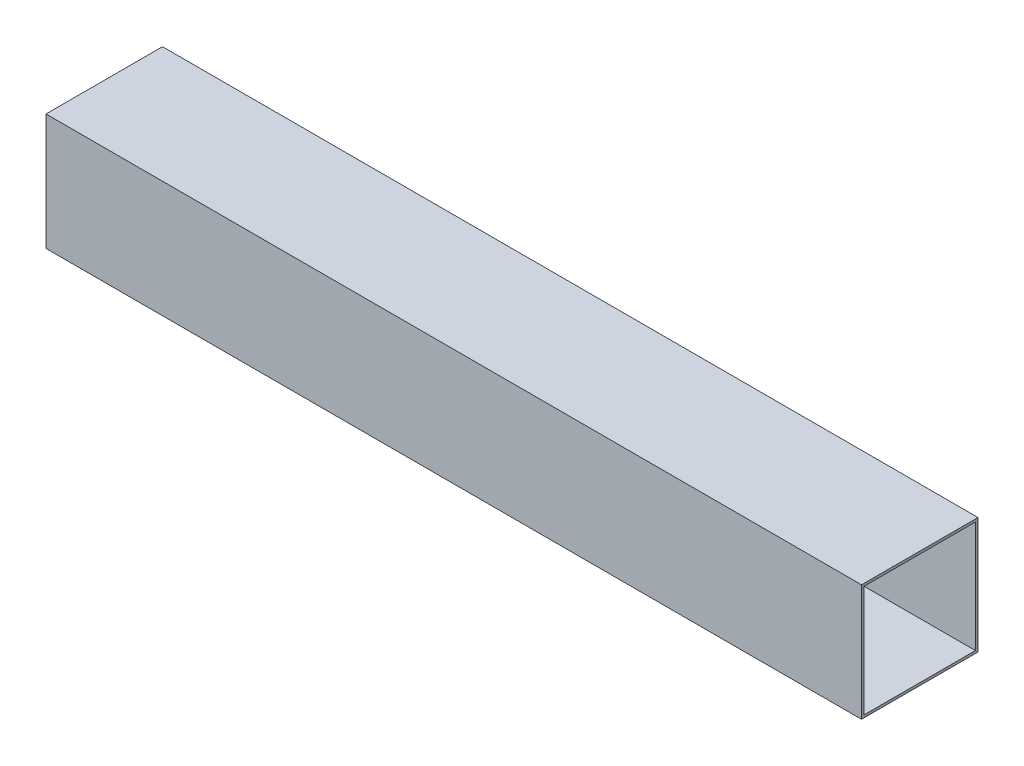
from build123d import *

# Parameters (mm, degrees)
SKETCH11_W                             = 25.4
SKETCH11_H                             = 25.4
SKETCH11_W_2                           = 24.2824
SKETCH11_H_2                           = 24.2824
AL_TUBE_SQUARE_1_SQ_X_022_WALL_5_DEPTH = 177.8


with BuildPart() as part:
    # Sketch11 → Al tube (square) 1 SQ X .022 WALL(5) (new body)
    with BuildSketch(Plane.YZ):
        Rectangle(SKETCH11_W, SKETCH11_H)
        Rectangle(SKETCH11_W_2, SKETCH11_H_2, mode=Mode.SUBTRACT)
    extrude(amount=AL_TUBE_SQUARE_1_SQ_X_022_WALL_5_DEPTH)


solid = part.part
